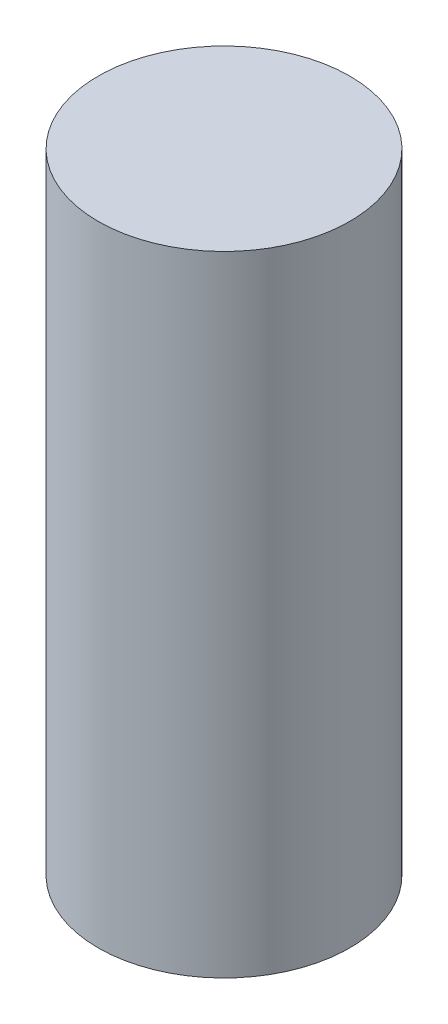
from build123d import *

# Parameters (mm, degrees)
SKETCH2_R           = 20
BOSS_EXTRUDE1_DEPTH = 100


with BuildPart() as part:
    # Sketch2 → Boss-Extrude1 (new body)
    with BuildSketch(Plane(origin=(0, 0, 0), x_dir=(1, 0, 0), z_dir=(0, 1, 0))):
        with Locations(Location((0, 0, 0), (0, 0, 270))):
            Circle(SKETCH2_R)
    extrude(amount=BOSS_EXTRUDE1_DEPTH)


solid = part.part
